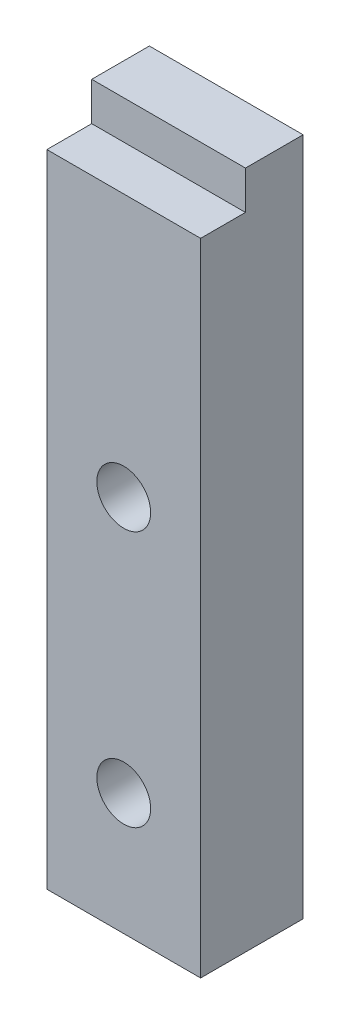
from build123d import *

# Parameters (mm, degrees)
SKETCH1_W           = 12
SKETCH1_H           = 50
SKETCH1_R           = 2.1
BOSS_EXTRUDE1_DEPTH = 8
SKETCH2_W           = 12
SKETCH2_H           = 4.5
BOSS_EXTRUDE2_DEPTH = 3


with BuildPart() as part:
    # Sketch1 → Boss-Extrude1 (new body)
    with BuildSketch(Plane.XY):
        with Locations((6, 25)):
            Rectangle(SKETCH1_W, SKETCH1_H)
        with Locations((6, 29.5)):
            Circle(SKETCH1_R, mode=Mode.SUBTRACT)
        with Locations((6, 9.5)):
            Circle(SKETCH1_R, mode=Mode.SUBTRACT)
    extrude(amount=BOSS_EXTRUDE1_DEPTH)

    # Sketch2 → Boss-Extrude2 (add)
    with BuildSketch(Plane(origin=(0, 50, 0), x_dir=(1, 0, 0), z_dir=(0, 1, 0))):
        with Locations((6, -2.25)):
            Rectangle(SKETCH2_W, SKETCH2_H)
    extrude(amount=BOSS_EXTRUDE2_DEPTH)


solid = part.part
